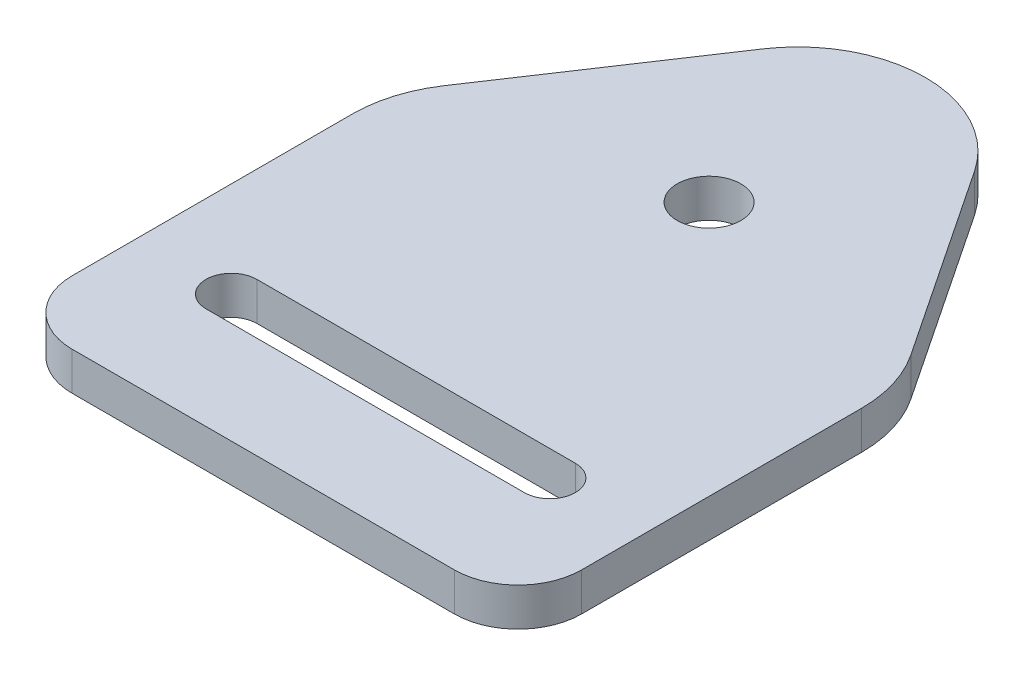
from build123d import *
from OCP.BRepFilletAPI import BRepFilletAPI_MakeFillet

# Parameters (mm, degrees)
BOSS_EXTRUDE1_DEPTH = 3
FILLET1_R1          = 10
FILLET1_R2          = 5
SKETCH2_R           = 2.5
CUT_EXTRUDE1_DEPTH  = 56.768397029


with BuildPart() as part:
    # Sketch1 → Boss-Extrude1 (new body)
    with BuildSketch(Plane(origin=(0, 0, 0), x_dir=(1, 0, 0), z_dir=(0, 1, 0))):
        Polygon((-20, 0), (20, 0), (20, 30), (0, 60), (-20, 30), align=None)
    extrude(amount=BOSS_EXTRUDE1_DEPTH)

    # Fillet1: one fillet with a radius per group of edges: ONE call of the kernel's fillet builder (fillet() takes one radius for all edges)
    fillet1_edges_1 = [part.edges().sort_by_distance(p)[0] for p in [
        (20, 1.5, -30),
        (-20, 1.5, -30),
        (0, 1.5, -60),
    ]]
    fillet1_edges_2 = [part.edges().sort_by_distance(p)[0] for p in [
        (20, 1.5, 0),
        (-20, 1.5, 0),
    ]]
    fillet1 = BRepFilletAPI_MakeFillet(part.part.solid().wrapped)
    for e in fillet1_edges_1:
        fillet1.Add(FILLET1_R1, e.wrapped)
    for e in fillet1_edges_2:
        fillet1.Add(FILLET1_R2, e.wrapped)
    add(Compound.cast(fillet1.Shape()), mode=Mode.REPLACE)

    # Sketch2 → Cut-Extrude1 (cut, through all)
    with BuildSketch(Plane(origin=(0, 3, 0), x_dir=(1, 0, 0), z_dir=(0, 1, 0))):
        with Locations((0, 35)):
            Circle(SKETCH2_R)
        with BuildLine():
            Line((-12.5, 12), (12.5, 12))
            ThreePointArc((12.5, 12), (14.5, 10), (12.5, 8))
            Line((12.5, 8), (-12.5, 8))
            ThreePointArc((-12.5, 8), (-14.5, 10), (-12.5, 12))
        make_face()
    extrude(amount=-CUT_EXTRUDE1_DEPTH, mode=Mode.SUBTRACT)


solid = part.part
